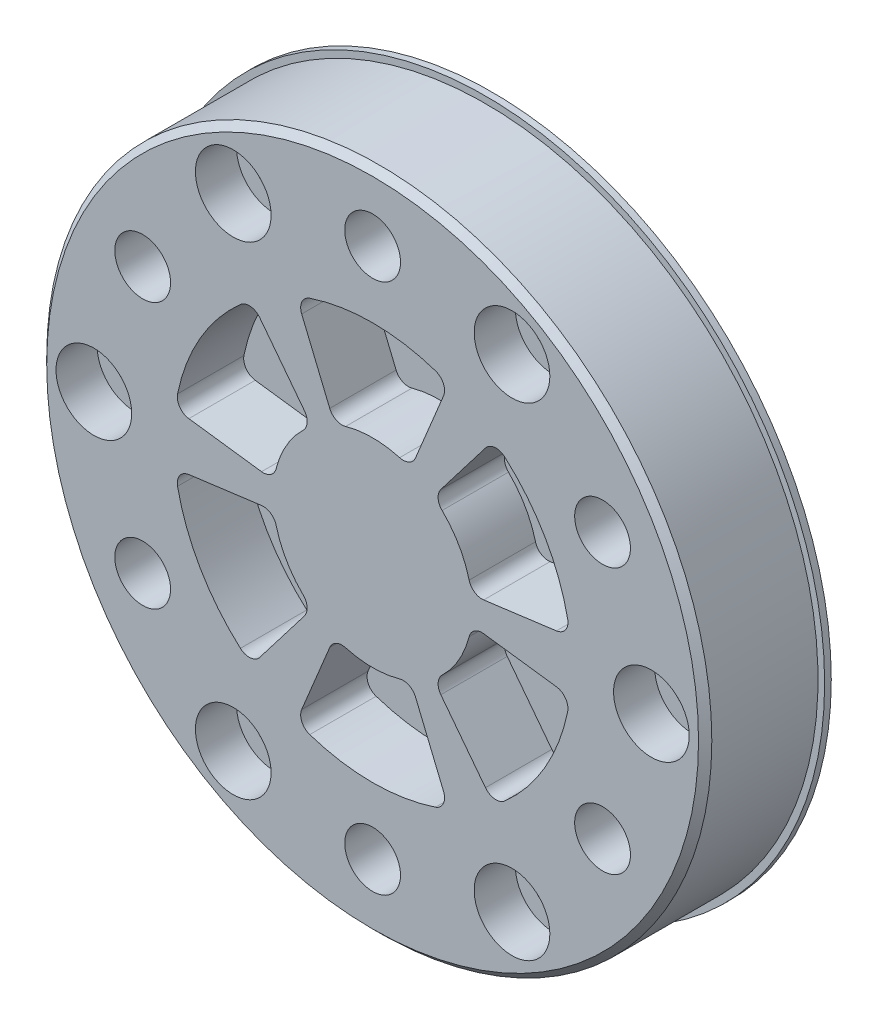
from build123d import *

# Parameters (mm, degrees)
OUTPUT_MASTER_SKETCH_R   = 25.05
BOSS_EXTRUDE1_DEPTH      = 9
SKETCH4_R                = 2.85
CUT_EXTRUDE1_DEPTH       = 4
SKETCH5_R                = 25.55
SKETCH5_R_2              = 25.05
BOSS_EXTRUDE2_DEPTH      = 0.5
SKETCH6_R                = 1.55
CUT_EXTRUDE2_DEPTH       = 38.237145433
CUT_EXTRUDE3_START       = -3.1
SKETCH7_R                = 2.85
CUT_EXTRUDE3_DEPTH       = 3.1
CHAMFER1_SIZE            = 0.5
SKETCH10_R               = 2.1
M4_THRU_DEPTH            = 38.237145433
CUT_EXTRUDE4_DEPTH       = 5
FILLET1_R                = 1
CIRPATTERN1_COUNT        = 6
FILLET1_OF_CIRPATTERN1_R = 1


with BuildPart() as part:
    # Output Master Sketch → Boss-Extrude1 (new body)
    with BuildSketch(Plane.XY):
        Circle(OUTPUT_MASTER_SKETCH_R)
    extrude(amount=BOSS_EXTRUDE1_DEPTH)

    # Sketch4 → Cut-Extrude1 (cut)
    with BuildSketch(Plane.XY):
        with Locations((21, 0)):
            Circle(SKETCH4_R)
        with Locations((10.5, -18.186533479)):
            Circle(SKETCH4_R)
        with Locations((-10.5, -18.186533479)):
            Circle(SKETCH4_R)
        with Locations((-21, 0)):
            Circle(SKETCH4_R)
        with Locations((-10.5, 18.186533479)):
            Circle(SKETCH4_R)
        with Locations((10.5, 18.186533479)):
            Circle(SKETCH4_R)
    extrude(amount=CUT_EXTRUDE1_DEPTH, mode=Mode.SUBTRACT)

    # Sketch5 → Boss-Extrude2 (add)
    with BuildSketch(Plane(origin=(0, 0, 0), x_dir=(-1, 0, 0), z_dir=(0, 0, -1))):
        Circle(SKETCH5_R)
        Circle(SKETCH5_R_2, mode=Mode.SUBTRACT)
    extrude(amount=-BOSS_EXTRUDE2_DEPTH)

    # Sketch6 → Cut-Extrude2 (cut, through all)
    with BuildSketch(Plane(origin=(0, 0, 0), x_dir=(-1, 0, 0), z_dir=(0, 0, -1))):
        with Locations((-21, 0)):
            Circle(SKETCH6_R)
        with Locations((-10.5, 18.186533479)):
            Circle(SKETCH6_R)
        with Locations((10.5, 18.186533479)):
            Circle(SKETCH6_R)
        with Locations((21, 0)):
            Circle(SKETCH6_R)
        with Locations((10.5, -18.186533479)):
            Circle(SKETCH6_R)
        with Locations((-10.5, -18.186533479)):
            Circle(SKETCH6_R)
    extrude(amount=-CUT_EXTRUDE2_DEPTH, mode=Mode.SUBTRACT)

    # Sketch7 → Cut-Extrude3 (cut)
    with BuildSketch(Plane.XY.offset(9).offset(CUT_EXTRUDE3_START)):
        with Locations((-21, 0)):
            Circle(SKETCH7_R)
        with Locations((-10.5, 18.186533479)):
            Circle(SKETCH7_R)
        with Locations((10.5, 18.186533479)):
            Circle(SKETCH7_R)
        with Locations((21, 0)):
            Circle(SKETCH7_R)
        with Locations((10.5, -18.186533479)):
            Circle(SKETCH7_R)
        with Locations((-10.5, -18.186533479)):
            Circle(SKETCH7_R)
    extrude(amount=CUT_EXTRUDE3_DEPTH, mode=Mode.SUBTRACT)

    # Chamfer1
    chamfer1_edges = [part.edges().sort_by_distance(p)[0] for p in [
        (-25.05, 0, 9),
    ]]
    chamfer(chamfer1_edges, length=CHAMFER1_SIZE)

    # Sketch10 → M4 Thru (cut, through all)
    with BuildSketch(Plane.XY.offset(9)):
        with Locations((0, 20)):
            Circle(SKETCH10_R)
        with Locations((17.320508076, 10)):
            Circle(SKETCH10_R)
        with Locations((17.320508076, -10)):
            Circle(SKETCH10_R)
        with Locations((0, -20)):
            Circle(SKETCH10_R)
        with Locations((-17.320508076, -10)):
            Circle(SKETCH10_R)
        with Locations((-17.320508076, 10)):
            Circle(SKETCH10_R)
    extrude(amount=-M4_THRU_DEPTH, mode=Mode.SUBTRACT)

    # Sketch12 → Cut-Extrude4 (cut)
    with BuildSketch(Plane.XY.offset(9)):
        with BuildLine():
            Line((0, 7.5), (0, 15))
            ThreePointArc((0, 15), (-2.92635483, 14.711779206), (-5.740251485, 13.858192988))
            Line((-5.740251485, 13.858192988), (-2.870125743, 6.929096494))
            ThreePointArc((-2.870125743, 6.929096494), (-1.463177415, 7.355889603), (0, 7.5))
        make_face()
        with BuildLine():
            ThreePointArc((5.740251485, 13.858192988), (2.92635483, 14.711779206), (0, 15))
            Line((0, 15), (0, 7.5))
            ThreePointArc((0, 7.5), (1.463177415, 7.355889603), (2.870125743, 6.929096494))
            Line((2.870125743, 6.929096494), (5.740251485, 13.858192988))
        make_face()
    cut_extrude4 = extrude(amount=-CUT_EXTRUDE4_DEPTH, mode=Mode.SUBTRACT)

    # Fillet1
    fillet1_edges = [part.edges().sort_by_distance(p)[0] for p in [
        (2.870125743, 6.929096494, 6.5),
        (-2.870125743, 6.929096494, 6.5),
        (-5.740251485, 13.858192988, 6.5),
        (5.740251485, 13.858192988, 6.5),
    ]]
    fillet(fillet1_edges, radius=FILLET1_R)

    # CirPattern1: Cut-Extrude4 ×6 about axis
    cirpattern1_axis = Axis((0, 0, 0), (0, 0, 1))
    for i in range(1, CIRPATTERN1_COUNT):
        add(cut_extrude4.rotate(cirpattern1_axis, i * 360 / CIRPATTERN1_COUNT), mode=Mode.SUBTRACT)

    # Fillet1 of CirPattern1
    fillet1_of_cirpattern1_edges = [part.edges().sort_by_distance(p)[0] for p in [
        (-4.565710718, 5.950150052, 6.5),
        (-7.43583646, 0.978946442, 6.5),
        (-14.871672921, 1.957892883, 6.5),
        (-9.131421435, 11.900300104, 6.5),
        (-7.43583646, -0.978946442, 6.5),
        (-4.565710718, -5.950150052, 6.5),
        (-9.131421435, -11.900300104, 6.5),
        (-14.871672921, -1.957892883, 6.5),
        (-2.870125743, -6.929096494, 6.5),
        (2.870125743, -6.929096494, 6.5),
        (5.740251485, -13.858192988, 6.5),
        (-5.740251485, -13.858192988, 6.5),
        (4.565710718, -5.950150052, 6.5),
        (7.43583646, -0.978946442, 6.5),
        (14.871672921, -1.957892883, 6.5),
        (9.131421435, -11.900300104, 6.5),
        (7.43583646, 0.978946442, 6.5),
        (4.565710718, 5.950150052, 6.5),
        (9.131421435, 11.900300104, 6.5),
        (14.871672921, 1.957892883, 6.5),
    ]]
    fillet(fillet1_of_cirpattern1_edges, radius=FILLET1_OF_CIRPATTERN1_R)


solid = part.part
